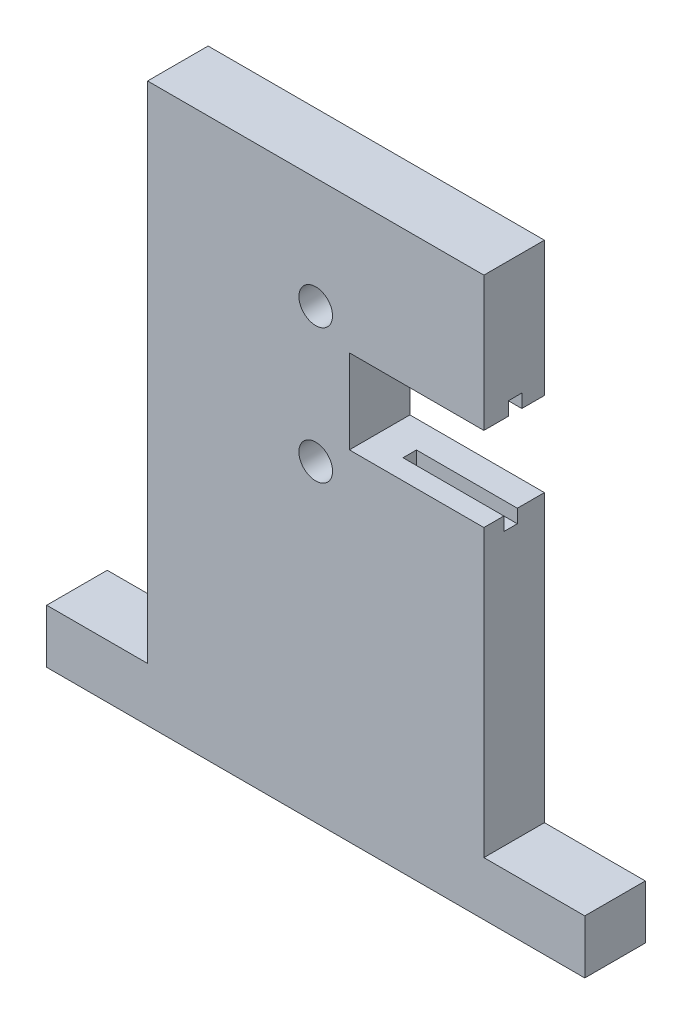
from build123d import *

# Parameters (mm, degrees)
ESQUISSE1_R             = 2.5
BOSS_EXTRU_1_DEPTH      = 9
ESQUISSE2_W             = 9
ESQUISSE2_H             = 12.5
ENL_V_MAT_EXTRU_2_DEPTH = 20
ESQUISSE4_W             = 15
ESQUISSE4_H             = 2
ENL_V_MAT_EXTRU_4_DEPTH = 2
ESQUISSE6_W             = 15
ESQUISSE6_H             = 2
ENL_V_MAT_EXTRU_5_DEPTH = 2


with BuildPart() as part:
    # Esquisse1 → Boss.-Extru.1 (new body)
    with BuildSketch(Plane.XY):
        Polygon((1.553236782, 0), (81.553236782, 0), (81.553236782, 8), (66.553236782, 8), (66.553236782, 83), (16.553236782, 83), (16.553236782, 8), (1.553236782, 8), align=None)
        with Locations((41.553236782, 46.5)):
            Circle(ESQUISSE1_R, mode=Mode.SUBTRACT)
        with Locations((41.553236782, 66.5)):
            Circle(ESQUISSE1_R, mode=Mode.SUBTRACT)
    extrude(amount=-BOSS_EXTRU_1_DEPTH)

    # Esquisse2 → Enlèv. mat.-Extru.2 (cut)
    with BuildSketch(Plane(origin=(66.553236782, 0, 0), x_dir=(0, 0, -1), z_dir=(1, 0, 0))):
        with Locations((4.5, 56.75)):
            Rectangle(ESQUISSE2_W, ESQUISSE2_H)
    extrude(amount=-ENL_V_MAT_EXTRU_2_DEPTH, mode=Mode.SUBTRACT)

    # Esquisse4 → Enlèv. mat.-Extru.4 (cut)
    with BuildSketch(Plane(origin=(0, 50.5, 0), x_dir=(1, 0, 0), z_dir=(0, 1, 0))):
        with Locations((59.053236782, 3.973765147)):
            Rectangle(ESQUISSE4_W, ESQUISSE4_H)
    extrude(amount=-ENL_V_MAT_EXTRU_4_DEPTH, mode=Mode.SUBTRACT)

    # Esquisse6 → Enlèv. mat.-Extru.5 (cut)
    with BuildSketch(Plane.XZ.offset(-63)):
        with Locations((59.053236782, -4.638650815)):
            Rectangle(ESQUISSE6_W, ESQUISSE6_H)
    extrude(amount=-ENL_V_MAT_EXTRU_5_DEPTH, mode=Mode.SUBTRACT)


solid = part.part
